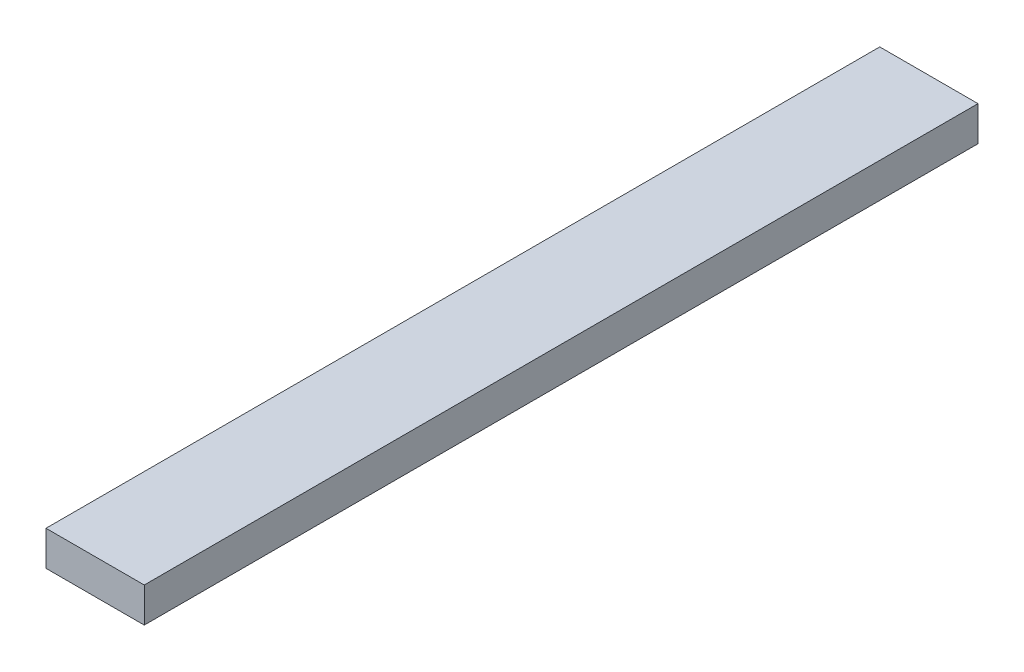
from build123d import *

# Parameters (mm, degrees)
SKETCH1_W           = 17.960512242
SKETCH1_H           = 6.35
BOSS_EXTRUDE1_DEPTH = 152.4


with BuildPart() as part:
    # Sketch1 → Boss-Extrude1 (new body)
    with BuildSketch(Plane.XY):
        with Locations((8.980256121, 3.175)):
            Rectangle(SKETCH1_W, SKETCH1_H)
    extrude(amount=BOSS_EXTRUDE1_DEPTH)


solid = part.part
